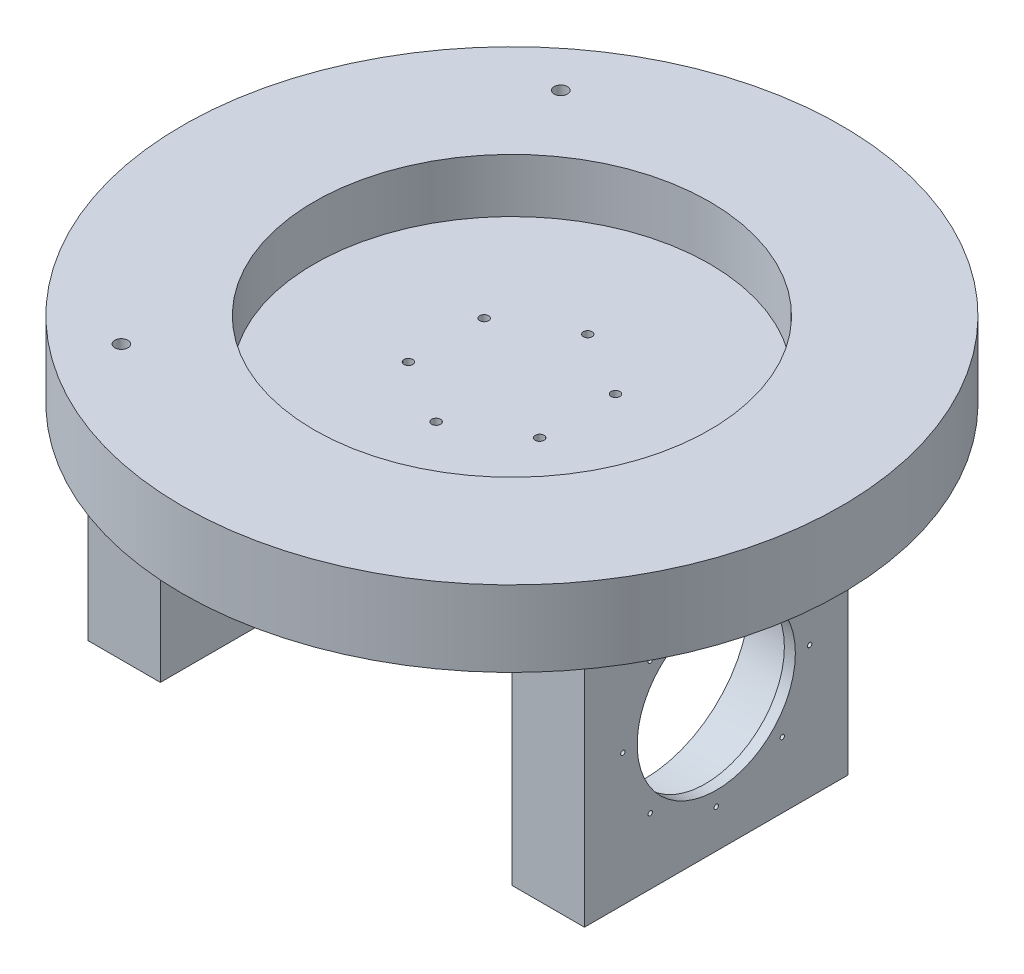
from build123d import *

# Parameters (mm, degrees)
SKETCH_1_R                       = 150
EXTRUDE_1_DEPTH                  = 34.5
EXTRUDE_2_DEPTH                  = 130
SKETCH_3_R                       = 48.25
CUT_EXTRUDE_1_DEPTH              = 314.765836254
SKETCH_4_R                       = 90
CUT_EXTRUDE_2_DEPTH              = 24.5
SKETCH_6_R                       = 48.25
EXTRUDE_3_DEPTH                  = 5
PATTERN_LINEAR_1_COUNT           = 2
PATTERN_LINEAR_1_PITCH           = 221
SKETCH_10_R                      = 32
CUT_EXTRUDE_3_DEPTH              = 5
SKETCH_11_R                      = 1
CUT_EXTRUDE_4_DEPTH              = 5
PATTERN_CIRCULAR_1_COUNT         = 8
PATTERN_LINEAR_3_COUNT           = 2
PATTERN_LINEAR_3_PITCH           = 221
PATTERN_LINEAR_3_COPY_1_SKETCH_R = 1
PATTERN_LINEAR_3_COPY_1_DEPTH    = 5
PATTERN_LINEAR_3_COPY_2_SKETCH_R = 1
PATTERN_LINEAR_3_COPY_2_DEPTH    = 5
PATTERN_LINEAR_3_COPY_3_SKETCH_R = 1
PATTERN_LINEAR_3_COPY_3_DEPTH    = 5
PATTERN_LINEAR_3_COPY_4_SKETCH_R = 1
PATTERN_LINEAR_3_COPY_4_DEPTH    = 5
PATTERN_LINEAR_3_COPY_5_SKETCH_R = 1
PATTERN_LINEAR_3_COPY_5_DEPTH    = 5
PATTERN_LINEAR_3_COPY_6_SKETCH_R = 1
PATTERN_LINEAR_3_COPY_6_DEPTH    = 5
PATTERN_LINEAR_3_COPY_7_SKETCH_R = 1
PATTERN_LINEAR_3_COPY_7_DEPTH    = 5
PATTERN_LINEAR_4_COUNT           = 2
PATTERN_LINEAR_4_PITCH           = 221
SKETCH_14_R                      = 3
CUT_EXTRUDE_5_DEPTH              = 249.797106092
SKETCH_16_R                      = 2
CUT_EXTRUDE_6_DEPTH              = 255.165300543
PATTERN_CIRCULAR_2_COUNT         = 6
SKETCH_17_R                      = 36
CUT_EXTRUDE_7_DEPTH              = 10


with BuildPart() as part:
    # 草图1 → 凸台-拉伸1 (new body)
    with BuildSketch(Plane(origin=(0, 0, 0), x_dir=(1, 0, 0), z_dir=(0, 1, 0))):
        with Locations(Location((0, 0, 0), (0, 0, 270))):
            Circle(SKETCH_1_R)
    extrude(amount=EXTRUDE_1_DEPTH)

    # 草图2 → 凸台-拉伸2 (add)
    with BuildSketch(Plane(origin=(0, 0, 0), x_dir=(-1, 0, 0), z_dir=(0, -1, 0))):
        Polygon((100, 0), (100, 60), (133, 60), (133, -60), (100, -60), align=None)
        Polygon((-60, 0), (-60, 60), (-93, 60), (-93, -60), (-60, -60), align=None)
    extrude(amount=EXTRUDE_2_DEPTH)

    # 草图3 → 切除-拉伸1 (cut, through all)
    with BuildSketch(Plane(origin=(93, 0, 0), x_dir=(0, 0, -1), z_dir=(1, 0, 0))):
        with Locations((0, -70)):
            Circle(SKETCH_3_R)
    extrude(amount=-CUT_EXTRUDE_1_DEPTH, mode=Mode.SUBTRACT)

    # 草图4 → 切除-拉伸2 (cut)
    with BuildSketch(Plane(origin=(0, 34.5, 0), x_dir=(1, 0, 0), z_dir=(0, 1, 0))):
        with Locations(Location((0, 0, 0), (0, 0, 270))):
            Circle(SKETCH_4_R)
    extrude(amount=-CUT_EXTRUDE_2_DEPTH, mode=Mode.SUBTRACT)

    # 草图6 → 凸台-拉伸3 (add)
    with BuildSketch(Plane(origin=(93, 0, 0), x_dir=(0, 0, -1), z_dir=(1, 0, 0))):
        with Locations((0, -70)):
            Circle(SKETCH_6_R)
    extrude_3 = extrude(amount=-EXTRUDE_3_DEPTH)

    # 阵列(线性)1: 凸台-拉伸3 ×2
    with Locations(*[(-i * PATTERN_LINEAR_1_PITCH, 0, 0) for i in range(1, PATTERN_LINEAR_1_COUNT)]):
        add(extrude_3)

    # 草图10 → 切除-拉伸3 (cut)
    with BuildSketch(Plane(origin=(93, 0, 0), x_dir=(0, 0, -1), z_dir=(1, 0, 0))):
        with Locations((0, -70)):
            Circle(SKETCH_10_R)
    cut_extrude_3 = extrude(amount=-CUT_EXTRUDE_3_DEPTH, mode=Mode.SUBTRACT)

    # 草图11 → 切除-拉伸4 (cut)
    with BuildSketch(Plane(origin=(93, 0, 0), x_dir=(0, 0, -1), z_dir=(1, 0, 0))):
        with Locations((0, -27.5)):
            Circle(SKETCH_11_R)
    cut_extrude_4 = extrude(amount=-CUT_EXTRUDE_4_DEPTH, mode=Mode.SUBTRACT)

    # 阵列(圆周)1: 切除-拉伸4 ×8 about axis
    pattern_circular_1_axis = Axis((0, -70, 0), (1, 0, 0))
    for i in range(1, PATTERN_CIRCULAR_1_COUNT):
        add(cut_extrude_4.rotate(pattern_circular_1_axis, i * 360 / PATTERN_CIRCULAR_1_COUNT), mode=Mode.SUBTRACT)

    # 阵列(线性)3: 切除-拉伸4 ×2
    with Locations(*[(-i * PATTERN_LINEAR_3_PITCH, 0, 0) for i in range(1, PATTERN_LINEAR_3_COUNT)]):
        add(cut_extrude_4, mode=Mode.SUBTRACT)

    # 阵列(线性)3 copy 1 sketch → 阵列(线性)3 copy 1 (cut)
    with BuildSketch(Plane(origin=(-128, -20.502525317, 49.497474683), x_dir=(0, 0.7071067811865475, -0.7071067811865476), z_dir=(1, 0, 0))):
        with Locations((0, -27.5)):
            Circle(PATTERN_LINEAR_3_COPY_1_SKETCH_R)
    extrude(amount=-PATTERN_LINEAR_3_COPY_1_DEPTH, mode=Mode.SUBTRACT)

    # 阵列(线性)3 copy 2 sketch → 阵列(线性)3 copy 2 (cut)
    with BuildSketch(Plane(origin=(-128, -70, 70), x_dir=(0, 1, 0), z_dir=(1, 0, 0))):
        with Locations((0, -27.5)):
            Circle(PATTERN_LINEAR_3_COPY_2_SKETCH_R)
    extrude(amount=-PATTERN_LINEAR_3_COPY_2_DEPTH, mode=Mode.SUBTRACT)

    # 阵列(线性)3 copy 3 sketch → 阵列(线性)3 copy 3 (cut)
    with BuildSketch(Plane(origin=(-128, -119.497474683, 49.497474683), x_dir=(0, 0.7071067811865476, 0.7071067811865475), z_dir=(1, 0, 0))):
        with Locations((0, -27.5)):
            Circle(PATTERN_LINEAR_3_COPY_3_SKETCH_R)
    extrude(amount=-PATTERN_LINEAR_3_COPY_3_DEPTH, mode=Mode.SUBTRACT)

    # 阵列(线性)3 copy 4 sketch → 阵列(线性)3 copy 4 (cut)
    with BuildSketch(Plane(origin=(-128, -140, 0), x_dir=(0, 0, 1), z_dir=(1, 0, 0))):
        with Locations((0, -27.5)):
            Circle(PATTERN_LINEAR_3_COPY_4_SKETCH_R)
    extrude(amount=-PATTERN_LINEAR_3_COPY_4_DEPTH, mode=Mode.SUBTRACT)

    # 阵列(线性)3 copy 5 sketch → 阵列(线性)3 copy 5 (cut)
    with BuildSketch(Plane(origin=(-128, -119.497474683, -49.497474683), x_dir=(0, -0.7071067811865475, 0.7071067811865477), z_dir=(1, 0, 0))):
        with Locations((0, -27.5)):
            Circle(PATTERN_LINEAR_3_COPY_5_SKETCH_R)
    extrude(amount=-PATTERN_LINEAR_3_COPY_5_DEPTH, mode=Mode.SUBTRACT)

    # 阵列(线性)3 copy 6 sketch → 阵列(线性)3 copy 6 (cut)
    with BuildSketch(Plane(origin=(-128, -70, -70), x_dir=(0, -1, 0), z_dir=(1, 0, 0))):
        with Locations((0, -27.5)):
            Circle(PATTERN_LINEAR_3_COPY_6_SKETCH_R)
    extrude(amount=-PATTERN_LINEAR_3_COPY_6_DEPTH, mode=Mode.SUBTRACT)

    # 阵列(线性)3 copy 7 sketch → 阵列(线性)3 copy 7 (cut)
    with BuildSketch(Plane(origin=(-128, -20.502525317, -49.497474683), x_dir=(0, -0.7071067811865477, -0.7071067811865474), z_dir=(1, 0, 0))):
        with Locations((0, -27.5)):
            Circle(PATTERN_LINEAR_3_COPY_7_SKETCH_R)
    extrude(amount=-PATTERN_LINEAR_3_COPY_7_DEPTH, mode=Mode.SUBTRACT)

    # 阵列(线性)4: 切除-拉伸3 ×2
    with Locations(*[(-i * PATTERN_LINEAR_4_PITCH, 0, 0) for i in range(1, PATTERN_LINEAR_4_COUNT)]):
        add(cut_extrude_3, mode=Mode.SUBTRACT)

    # 草图14 → 切除-拉伸5 (cut, through all)
    with BuildSketch(Plane.XZ):
        with Locations(Location((-77.76, -100, 0), (0, 0, 270))):
            Circle(SKETCH_14_R)
    cut_extrude_5 = extrude(amount=-CUT_EXTRUDE_5_DEPTH, mode=Mode.SUBTRACT)

    # 镜向1: 切除-拉伸5 across plane
    add(cut_extrude_5.mirror(Plane.XY), mode=Mode.SUBTRACT)

    # 草图16 → 切除-拉伸6 (cut, through all)
    with BuildSketch(Plane(origin=(0, 10, 0), x_dir=(1, 0, 0), z_dir=(0, 1, 0))):
        with Locations(Location((0, 34.5, 0), (0, 0, 270))):
            Circle(SKETCH_16_R)
    cut_extrude_6 = extrude(amount=-CUT_EXTRUDE_6_DEPTH, mode=Mode.SUBTRACT)

    # 阵列(圆周)2: 切除-拉伸6 ×6 about axis
    pattern_circular_2_axis = Axis((0, 0, 0), (0, 1, 0))
    for i in range(1, PATTERN_CIRCULAR_2_COUNT):
        add(cut_extrude_6.rotate(pattern_circular_2_axis, i * 360 / PATTERN_CIRCULAR_2_COUNT), mode=Mode.SUBTRACT)

    # 草图17 → 切除-拉伸7 (cut)
    with BuildSketch(Plane(origin=(93, 0, 0), x_dir=(0, 0, -1), z_dir=(1, 0, 0))):
        with Locations((0, -70)):
            Circle(SKETCH_17_R)
    extrude(amount=-CUT_EXTRUDE_7_DEPTH, mode=Mode.SUBTRACT)


solid = part.part
